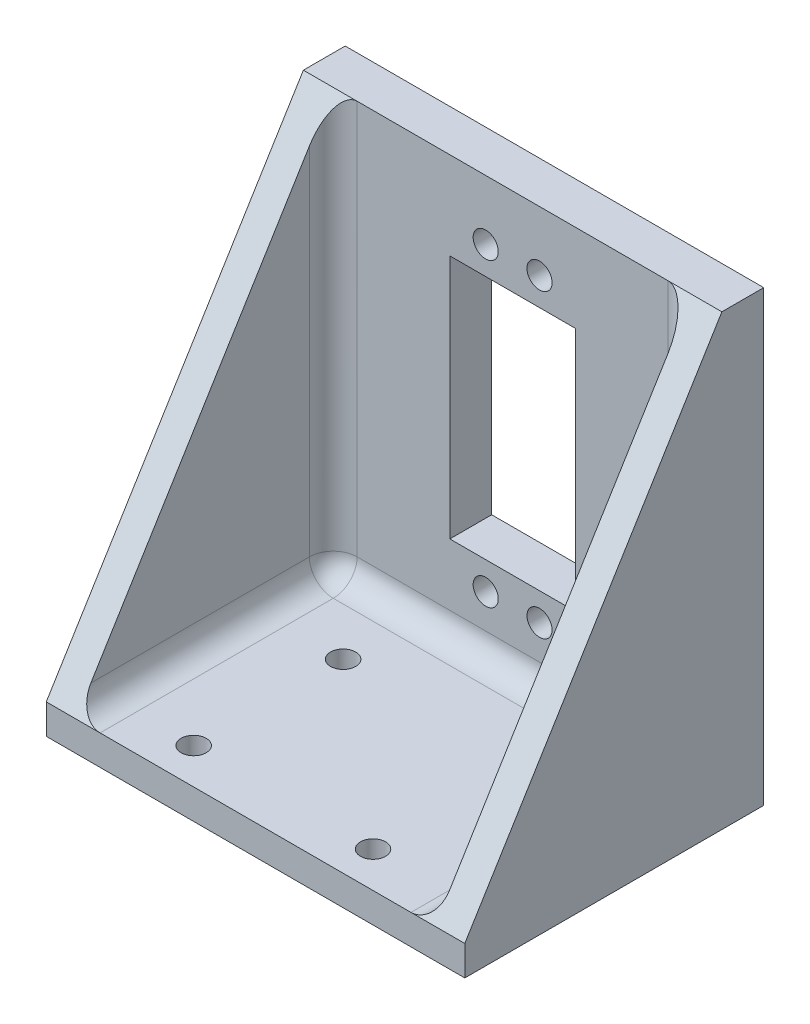
from build123d import *

# Parameters (mm, degrees)
SKETCH1_W           = 70
SKETCH1_H           = 50
BOSS_EXTRUDE1_DEPTH = 5
SKETCH2_W           = 70
SKETCH2_H           = 7
BOSS_EXTRUDE2_DEPTH = 70
SKETCH3_R           = 2.1
SKETCH3_W           = 21
SKETCH3_H           = 41
CUT_EXTRUDE1_DEPTH  = 70
BOSS_EXTRUDE3_DEPTH = 5
BOSS_EXTRUDE4_DEPTH = 5
SKETCH8_R           = 2.1
CUT_EXTRUDE2_DEPTH  = 5
FILLET1_R           = 4
FILLET2_R           = 4


with BuildPart() as part:
    # Sketch1 → Boss-Extrude1 (new body)
    with BuildSketch(Plane(origin=(0, 0, 0), x_dir=(1, 0, 0), z_dir=(0, 1, 0))):
        Rectangle(SKETCH1_W, SKETCH1_H)
    extrude(amount=BOSS_EXTRUDE1_DEPTH)

    # Sketch2 → Boss-Extrude2 (add)
    with BuildSketch(Plane(origin=(0, 5, 0), x_dir=(1, 0, 0), z_dir=(0, 1, 0))):
        with Locations((0, 21.5)):
            Rectangle(SKETCH2_W, SKETCH2_H)
    extrude(amount=BOSS_EXTRUDE2_DEPTH)

    # Sketch3 → Cut-Extrude1 (cut)
    with BuildSketch(Plane(origin=(0, 0, -25), x_dir=(-1, 0, 0), z_dir=(0, 0, -1))):
        with Locations((-4.5, 65)):
            Circle(SKETCH3_R)
        with Locations((4.5, 65)):
            Circle(SKETCH3_R)
        with Locations((4.5, 14.7)):
            Circle(SKETCH3_R)
        with Locations((-4.5, 14.7)):
            Circle(SKETCH3_R)
        with Locations((0, 39.85)):
            Rectangle(SKETCH3_W, SKETCH3_H)
    extrude(amount=-CUT_EXTRUDE1_DEPTH, mode=Mode.SUBTRACT)

    # Sketch6 → Boss-Extrude3 (add)
    with BuildSketch(Plane.ZY.offset(35)):
        Polygon((-18, 75), (25, 5), (-18, 5), align=None)
    extrude(amount=-BOSS_EXTRUDE3_DEPTH)

    # Sketch7 → Boss-Extrude4 (add)
    with BuildSketch(Plane(origin=(35, 0, 0), x_dir=(0, 0, -1), z_dir=(1, 0, 0))):
        Polygon((18, 75), (-25, 5), (18, 5), align=None)
    extrude(amount=-BOSS_EXTRUDE4_DEPTH)

    # Sketch8 → Cut-Extrude2 (cut)
    with BuildSketch(Plane(origin=(0, 5, 0), x_dir=(1, 0, 0), z_dir=(0, 1, 0))):
        with Locations(Location((-16.347962706, 6, 0), (0, 0, 270))):
            Circle(SKETCH8_R)
        with Locations(Location((13.652037294, 6, 0), (0, 0, 270))):
            Circle(SKETCH8_R)
        with Locations(Location((-16.347962706, -19, 0), (0, 0, 270))):
            Circle(SKETCH8_R)
        with Locations(Location((13.652037294, -19, 0), (0, 0, 270))):
            Circle(SKETCH8_R)
    extrude(amount=-CUT_EXTRUDE2_DEPTH, mode=Mode.SUBTRACT)

    # Fillet1
    fillet1_edges = [part.edges().sort_by_distance(p)[0] for p in [
        (0, 5, -18),
    ]]
    fillet(fillet1_edges, radius=FILLET1_R)

    # Fillet2
    fillet2_edges = [part.edges().sort_by_distance(p)[0] for p in [
        (30, 42, -18),
        (30, 6.171572875, -16.828427125),
        (-30, 5, 5.5),
        (-30, 6.171572875, -16.828427125),
        (-30, 42, -18),
        (30, 5, 5.5),
    ]]
    fillet(fillet2_edges, radius=FILLET2_R)


solid = part.part
